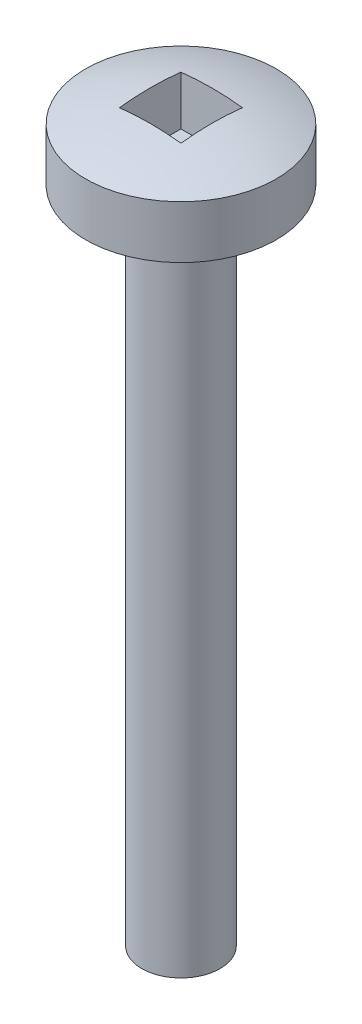
from build123d import *

# Parameters (mm, degrees)
SKETCH1_R            = 1.1303
THREADS_DEPTH        = 19.05
SKETCH2_R            = 2.7559
HEAD_DEPTH           = 1.524
HEADDOME_FACE_RADIUS = 2.7559
HEADDOME_HEIGHT      = 0.508
SKETCH3_W            = 1.778
SKETCH3_H            = 1.778
DRIVER_DEPTH         = 1.524


with BuildPart() as part:
    # Sketch1 → threads (new body)
    with BuildSketch(Plane(origin=(0, 0, 0), x_dir=(1, 0, 0), z_dir=(0, 1, 0))):
        with Locations(Location((0, 0, 0), (0, 0, 270))):
            Circle(SKETCH1_R)
    extrude(amount=-THREADS_DEPTH)

    # Sketch2 → Head (add)
    with BuildSketch(Plane(origin=(0, 0, 0), x_dir=(1, 0, 0), z_dir=(0, 1, 0))):
        with Locations(Location((0, 0, 0), (0, 0, 90))):
            Circle(SKETCH2_R)
    extrude(amount=HEAD_DEPTH)

    # HeadDome: a dome of height H over a round flat face of radius A is a cap of a sphere of radius (A * A + H * H) / (2 * H)
    headdome_r = (HEADDOME_FACE_RADIUS * HEADDOME_FACE_RADIUS + HEADDOME_HEIGHT * HEADDOME_HEIGHT) / (2 * HEADDOME_HEIGHT)
    headdome_base = Plane((0, 1.524, 0), z_dir=(0, 1, 0))
    with Locations(headdome_base.offset(HEADDOME_HEIGHT - headdome_r)):
        headdome_ball = Sphere(headdome_r, mode=Mode.PRIVATE)
    add(split(headdome_ball, bisect_by=headdome_base, keep=Keep.TOP, mode=Mode.PRIVATE))

    # Sketch3 → Driver (cut)
    with BuildSketch(Plane(origin=(0, 2.032, 0), x_dir=(1, 0, 0), z_dir=(0, 1, 0))):
        Rectangle(SKETCH3_W, SKETCH3_H)
    extrude(amount=-DRIVER_DEPTH, mode=Mode.SUBTRACT)


solid = part.part
